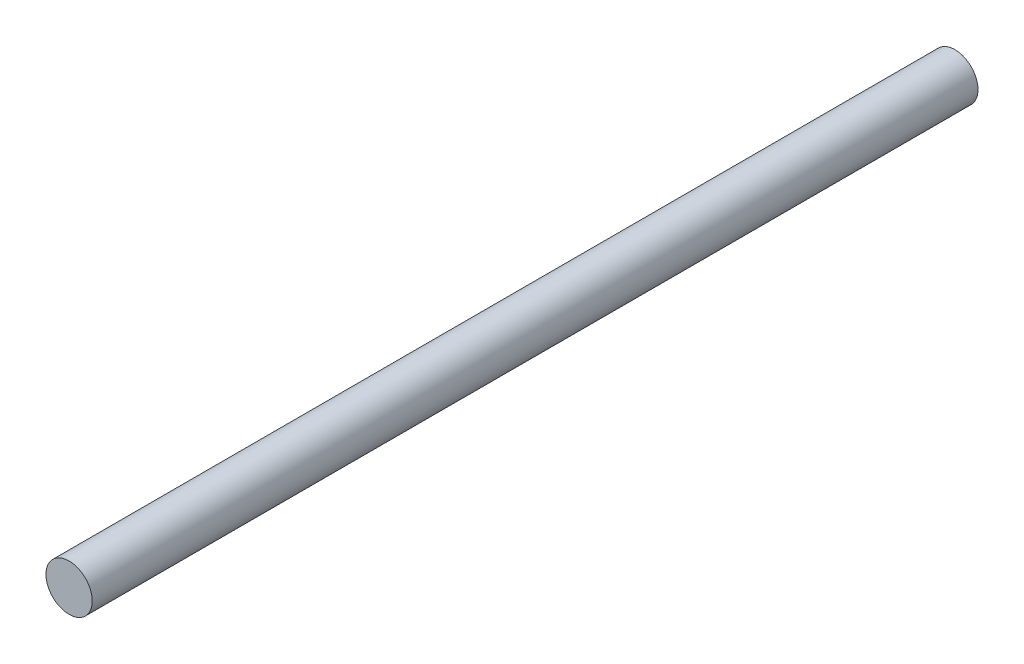
from build123d import *

# Parameters (mm, degrees)
SKETCH_1_R      = 9
EXTRUDE_1_DEPTH = 172.3


with BuildPart() as part:
    # Эскиз1 → Бобышка-Вытянуть1 (new body)
    with BuildSketch(Plane.XY):
        Circle(SKETCH_1_R)
    extrude(amount=EXTRUDE_1_DEPTH)

    # Зеркальное отражение1: part across plane


with BuildPart() as part_1:
    add(part.part)
    add(part.part.mirror(Plane.XY))


solid = part_1.part
